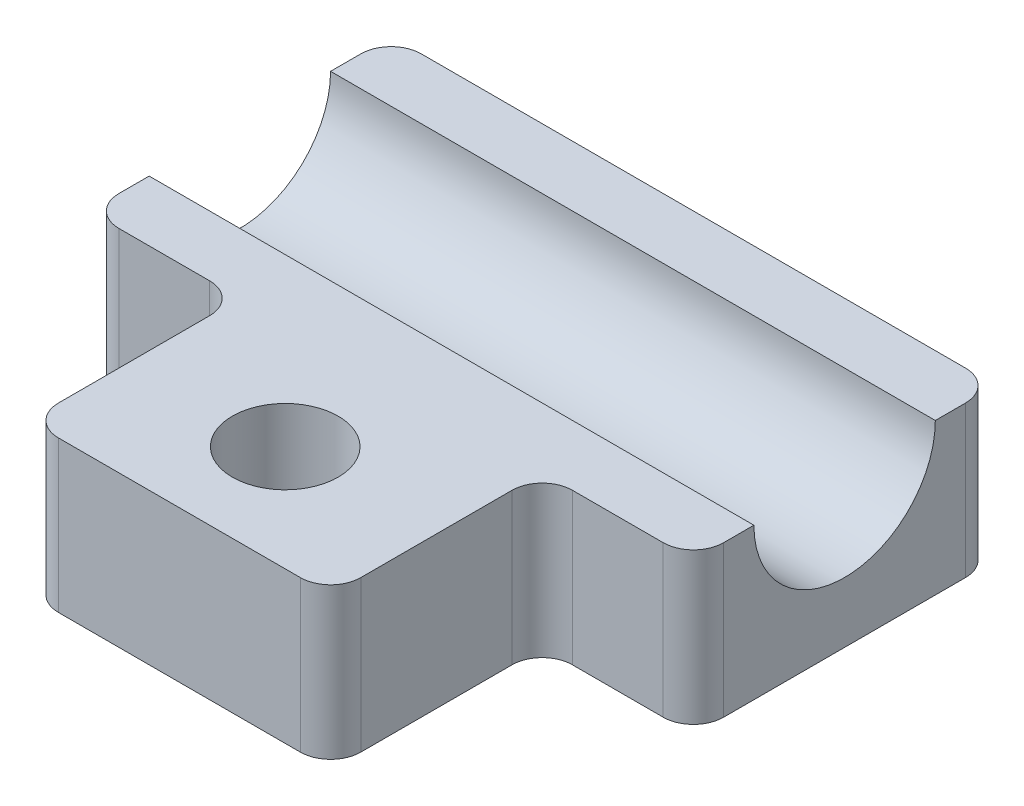
from build123d import *

# Parameters (mm, degrees)
BOSS_EXTRUDE1_DEPTH = 10
SKETCH2_R           = 3.5
CUT_EXTRUDE1_DEPTH  = 10
SKETCH3_R           = 6
CUT_EXTRUDE2_DEPTH  = 48.707441768
FILLET1_R           = 2


with BuildPart() as part:
    # Sketch1 → Boss-Extrude1 (new body)
    with BuildSketch(Plane(origin=(0, 0, 0), x_dir=(1, 0, 0), z_dir=(0, 1, 0))):
        Polygon((-10, -10), (-20, -10), (-20, 10), (20, 10), (20, -10), (10, -10), (10, -24), (-10, -24), align=None)
    extrude(amount=BOSS_EXTRUDE1_DEPTH)

    # Sketch2 → Cut-Extrude1 (cut)
    with BuildSketch(Plane(origin=(0, 10, 0), x_dir=(1, 0, 0), z_dir=(0, 1, 0))):
        with Locations(Location((0, -17, 0), (0, 0, 270))):
            Circle(SKETCH2_R)
    extrude(amount=-CUT_EXTRUDE1_DEPTH, mode=Mode.SUBTRACT)

    # Sketch3 → Cut-Extrude2 (cut, through all)
    with BuildSketch(Plane(origin=(20, 0, 0), x_dir=(0, 0, -1), z_dir=(1, 0, 0))):
        with Locations((0, 10)):
            Circle(SKETCH3_R)
    extrude(amount=-CUT_EXTRUDE2_DEPTH, mode=Mode.SUBTRACT)

    # Fillet1
    fillet1_edges = [part.edges().sort_by_distance(p)[0] for p in [
        (-20, 5, -10),
        (20, 5, -10),
        (20, 5, 10),
        (10, 5, 10),
        (10, 5, 24),
        (-10, 5, 24),
        (-10, 5, 10),
        (-20, 5, 10),
    ]]
    fillet(fillet1_edges, radius=FILLET1_R)


solid = part.part
